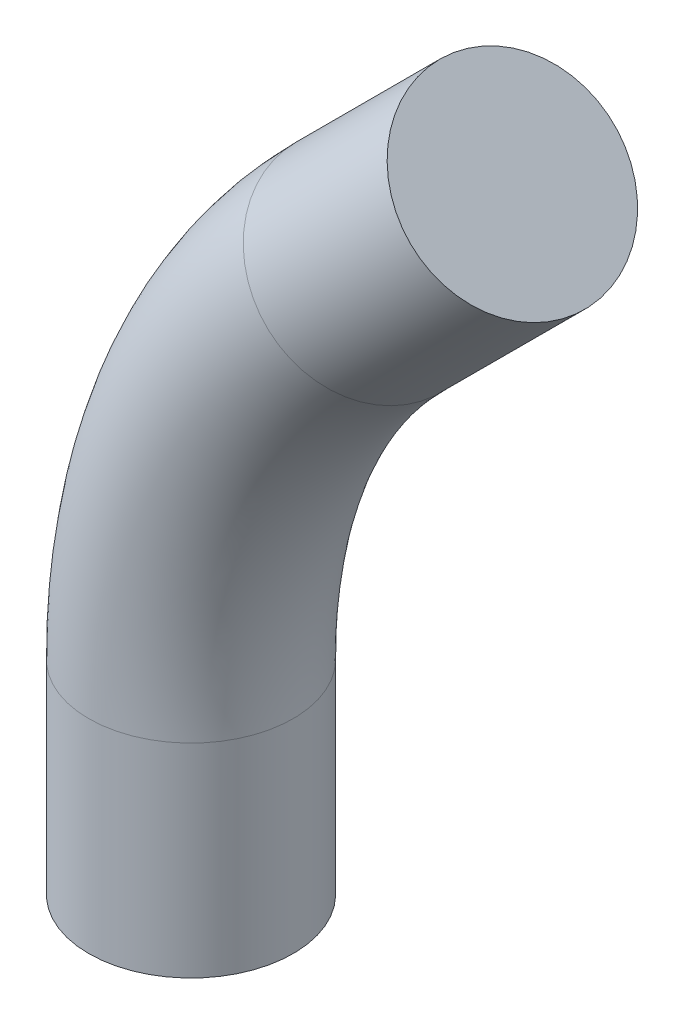
from build123d import *

# Parameters (mm, degrees)
SKETCH2_R = 6.75


with BuildPart() as part:
    # Sweep1: sweep along a path in Sketch1
    with BuildLine(Plane.XY) as sweep1_path:
        Line((0, 0), (0, 13.431457505))
        ThreePointArc((0, 13.431457505), (3.0448187, 28.7387948), (11.715728753, 41.715728753))
        Line((11.715728753, 41.715728753), (21.213203436, 51.213203436))
    # Sketch2 → Sweep1 (sweep)
    with BuildSketch(Plane(origin=(0, 0, 0), x_dir=(1, 0, 0), z_dir=(0, 1, 0))):
        Circle(SKETCH2_R)
    sweep(path=sweep1_path.line)


solid = part.part
